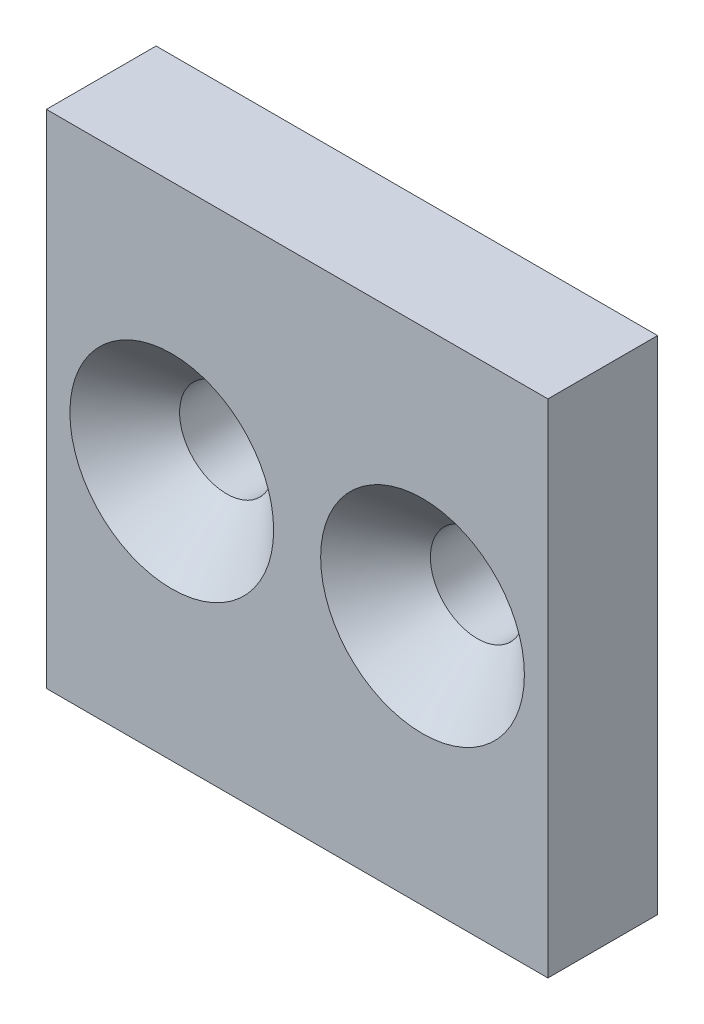
from build123d import *

# Parameters (mm, degrees)
SKETCH1_W                                           = 32
SKETCH1_H                                           = 32
BOSS_EXTRUDE1_DEPTH                                 = 7
CSK_FOR_M6_COUNTERSUNK_FLAT_HEAD_SCREW2_D           = 6
CSK_FOR_M6_COUNTERSUNK_FLAT_HEAD_SCREW2_DEPTH       = 23
CSK_FOR_M6_COUNTERSUNK_FLAT_HEAD_SCREW2_CSINK_D     = 13
CSK_FOR_M6_COUNTERSUNK_FLAT_HEAD_SCREW2_CSINK_ANGLE = 90
CSK_FOR_M6_COUNTERSUNK_FLAT_HEAD_SCREW2_TIP         = 1.802581857


with BuildPart() as part:
    # Sketch1 → Boss-Extrude1 (new body)
    with BuildSketch(Plane.XY):
        with Locations((38.880175665, -11.244087205)):
            Rectangle(SKETCH1_W, SKETCH1_H)
    extrude(amount=BOSS_EXTRUDE1_DEPTH)

    # CSK for M6 Countersunk Flat Head Screw2
    with Locations(Plane.XY.offset(7)):
        with Locations((30.880175665, -11.244087205), (46.880175665, -11.244087205)):
            CounterSinkHole(CSK_FOR_M6_COUNTERSUNK_FLAT_HEAD_SCREW2_D / 2, CSK_FOR_M6_COUNTERSUNK_FLAT_HEAD_SCREW2_CSINK_D / 2, depth=CSK_FOR_M6_COUNTERSUNK_FLAT_HEAD_SCREW2_DEPTH, counter_sink_angle=CSK_FOR_M6_COUNTERSUNK_FLAT_HEAD_SCREW2_CSINK_ANGLE)
            with Locations((0, 0, -(CSK_FOR_M6_COUNTERSUNK_FLAT_HEAD_SCREW2_DEPTH + CSK_FOR_M6_COUNTERSUNK_FLAT_HEAD_SCREW2_TIP / 2))):  # 118° drill point
                Cone(0, CSK_FOR_M6_COUNTERSUNK_FLAT_HEAD_SCREW2_D / 2, CSK_FOR_M6_COUNTERSUNK_FLAT_HEAD_SCREW2_TIP, mode=Mode.SUBTRACT)


solid = part.part
